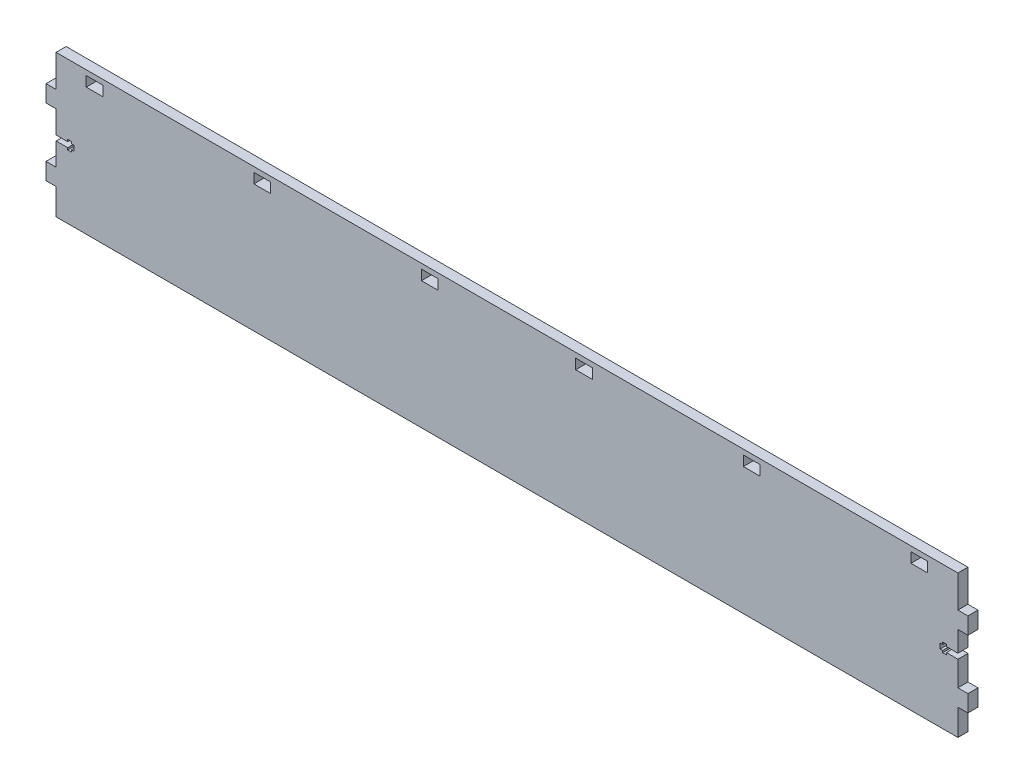
from build123d import *

# Parameters (mm, degrees)
SKETCH_1_W      = 10
SKETCH_1_H      = 6
EXTRUDE_1_DEPTH = 6


with BuildPart() as part:
    # Эскиз1 → Бобышка-Вытянуть1 (new body)
    with BuildSketch(Plane.XY):
        Polygon((-164.373633731, 3), (373.626366269, 3), (373.626366269, -16.168156269), (379.626366269, -16.168156269), (379.626366269, -26.168156269), (373.626366269, -26.168156269), (373.626366269, -38.45), (366.754885836, -38.45), (366.754885836, -37.25), (364.554885836, -37.25), (364.554885836, -38.45), (363.054885836, -38.45), (363.054885836, -41.55), (364.554885836, -41.55), (364.554885836, -42.75), (366.754885836, -42.75), (366.754885836, -41.55), (373.626366269, -41.55), (373.626366269, -56.331843731), (379.626366269, -56.331843731), (379.626366269, -66.331843731), (373.626366269, -66.331843731), (373.626366269, -82), (-164.373633731, -82), (-164.373633731, -66.331843731), (-170.373633731, -66.331843731), (-170.373633731, -56.331843731), (-164.373633731, -56.331843731), (-164.302153297, -42.8), (-164.230672864, -42.8), (-157.430672864, -42.8), (-157.430672864, -44), (-155.230672864, -44), (-155.230672864, -42.8), (-153.730672864, -42.8), (-153.730672864, -39.7), (-155.230672864, -39.7), (-155.230672864, -38.5), (-157.430672864, -38.5), (-157.430672864, -39.7), (-164.230672864, -39.7), (-164.302153297, -39.7), (-164.373633731, -26.168156269), (-170.373633731, -26.168156269), (-170.373633731, -16.168156269), (-164.373633731, -16.168156269), align=None)
        with Locations((-141.373633731, -3)):
            Rectangle(SKETCH_1_W, SKETCH_1_H, mode=Mode.SUBTRACT)
        with Locations((-41.373633731, -3)):
            Rectangle(SKETCH_1_W, SKETCH_1_H, mode=Mode.SUBTRACT)
        with Locations((58.626366269, -3)):
            Rectangle(SKETCH_1_W, SKETCH_1_H, mode=Mode.SUBTRACT)
        with Locations((150.626366269, -3)):
            Rectangle(SKETCH_1_W, SKETCH_1_H, mode=Mode.SUBTRACT)
        with Locations((250.626366269, -3)):
            Rectangle(SKETCH_1_W, SKETCH_1_H, mode=Mode.SUBTRACT)
        with Locations((350.626366269, -3)):
            Rectangle(SKETCH_1_W, SKETCH_1_H, mode=Mode.SUBTRACT)
    extrude(amount=EXTRUDE_1_DEPTH)


solid = part.part
